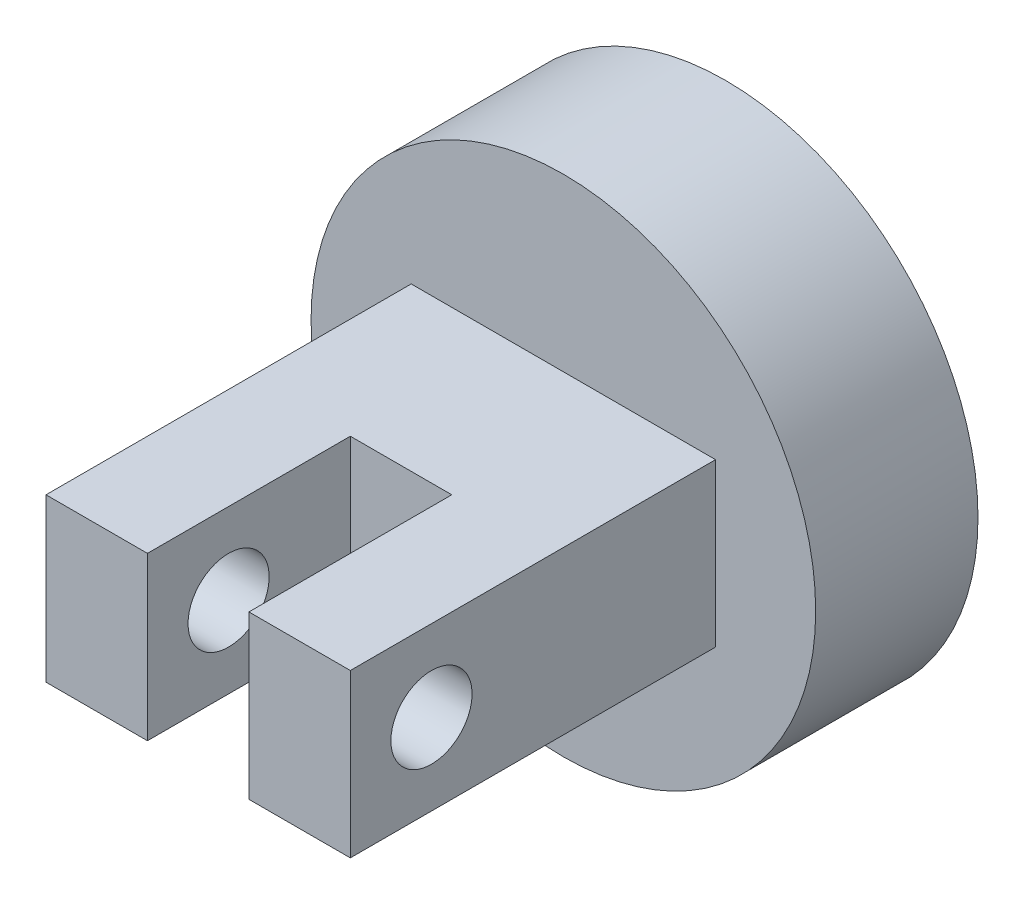
from build123d import *

# Parameters (mm, degrees)
SKETCH3_R           = 124.360538227
BOSS_EXTRUDE2_DEPTH = 80
SKETCH4_W           = 150
SKETCH4_H           = 80
BOSS_EXTRUDE4_DEPTH = 260
SKETCH5_R           = 20
CUT_EXTRUDE1_DEPTH  = 260
SKETCH6_W           = 50
SKETCH6_H           = 100
CUT_EXTRUDE2_DEPTH  = 260


with BuildPart() as part:
    # Sketch3 → Boss-Extrude2 (new body)
    with BuildSketch(Plane.XY):
        Circle(SKETCH3_R)
    extrude(amount=BOSS_EXTRUDE2_DEPTH)

    # Sketch4 → Boss-Extrude4 (add)
    with BuildSketch(Plane.XY):
        Rectangle(SKETCH4_W, SKETCH4_H)
    extrude(amount=BOSS_EXTRUDE4_DEPTH)

    # Sketch5 → Cut-Extrude1 (cut)
    with BuildSketch(Plane.ZY.offset(75)):
        with Locations((220, 0)):
            Circle(SKETCH5_R)
    extrude(amount=-CUT_EXTRUDE1_DEPTH, mode=Mode.SUBTRACT)

    # Sketch6 → Cut-Extrude2 (cut)
    with BuildSketch(Plane(origin=(0, 40, 0), x_dir=(1, 0, 0), z_dir=(0, 1, 0))):
        with Locations((0, -210)):
            Rectangle(SKETCH6_W, SKETCH6_H)
    extrude(amount=-CUT_EXTRUDE2_DEPTH, mode=Mode.SUBTRACT)


solid = part.part
